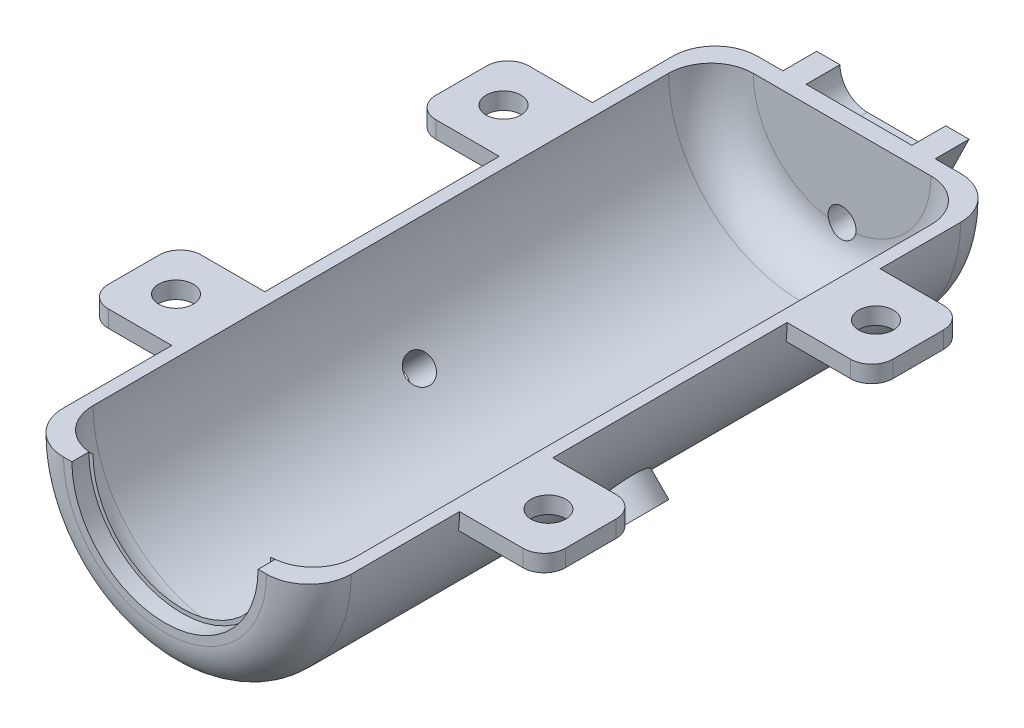
from build123d import *

# Parameters (mm, degrees)
SKETCH4_W               = 63.691174053
SKETCH4_H               = 96.012068348
CUT_EXTRUDE3_DEPTH      = 86.451740766
CUT_EXTRUDE4_DEPTH      = 86.451740766
CUT_EXTRUDE4_DEPTH_BACK = 86.451740766
SKETCH6_R               = 1.65
CUT_EXTRUDE5_DEPTH      = 90.173515588
CUT_EXTRUDE5_DEPTH_BACK = 90.173515588
SKETCH7_R               = 1.65
SKETCH9_R               = 1.65
CUT_EXTRUDE7_DEPTH      = 5
BOSS_EXTRUDE4_START     = 27
SKETCH16_R              = 3.65
SKETCH16_R_2            = 1.65
BOSS_EXTRUDE4_DEPTH     = 3.9
BOSS_EXTRUDE6_START     = -16
SKETCH17_R              = 3.65
SKETCH17_R_2            = 1.65
BOSS_EXTRUDE6_DEPTH     = 3.9
BOSS_EXTRUDE7_START     = 4
SKETCH18_R              = 1.65
BOSS_EXTRUDE7_DEPTH     = 4
CUT_EXTRUDE8_DEPTH      = 0.2
SKETCH22_R              = 2.05
BOSS_EXTRUDE8_DEPTH     = 2
MIRROR2_COPY_1_SKETCH_R = 2.05
MIRROR2_COPY_1_DEPTH    = 2


with BuildPart() as part:
    # Sketch1 → Revolve1 (revolve)
    with BuildSketch(Plane(origin=(0, 0, 0), x_dir=(0, 0, -1), z_dir=(1, 0, 0)), mode=Mode.PRIVATE) as revolve1_sk:
        with BuildLine():
            Line((0, 12), (0, 11))
            Line((0, 11), (2, 11))
            Line((2, 11), (2, 10.5))
            ThreePointArc((2, 10.5), (3.464466094, 14.035533906), (7, 15.5))
            Line((7, 15.5), (12, 15.5))
            Line((12, 15.5), (75, 15.5))
            ThreePointArc((75, 15.5), (78.535533906, 14.035533906), (80, 10.5))
            Line((80, 10.5), (80, 0))
            Line((80, 0), (82, 0))
            Line((82, 0), (82, 12))
            ThreePointArc((82, 12), (80.535533906, 15.535533906), (77, 17))
            Line((77, 17), (5, 17))
            ThreePointArc((5, 17), (1.464466094, 15.535533906), (0, 12))
        make_face()
    revolve(revolve1_sk.sketch.rotate(Axis((0, 0, 0), (0, 0, -1)), 180), axis=Axis((0, 0, 0), (0, 0, -1)))

    # Sketch4 → Cut-Extrude3 (cut, through all)
    with BuildSketch(Plane(origin=(0, 0, 0), x_dir=(1, 0, 0), z_dir=(0, 1, 0))):
        with Locations((-0.095061454, 42.091351984)):
            Rectangle(SKETCH4_W, SKETCH4_H)
    extrude(amount=CUT_EXTRUDE3_DEPTH, mode=Mode.SUBTRACT)

    # Sketch6 → Cut-Extrude4 (cut, two sides: drawn at the far end of the back side and taken through both)
    with BuildSketch(Plane(origin=(0, 0, 0), x_dir=(0.7071067811865477, 0.7071067811865475, 0), z_dir=(-0.7071067811865475, 0.7071067811865477, 0)).offset(-CUT_EXTRUDE4_DEPTH_BACK)):
        with Locations(Location((0, 41, 0), (0, 0, 180))):
            Circle(SKETCH6_R)
    extrude(amount=CUT_EXTRUDE4_DEPTH + CUT_EXTRUDE4_DEPTH_BACK, mode=Mode.SUBTRACT)

    # Sketch7 → Cut-Extrude5 (cut, two sides: drawn at the far end of the back side and taken through both)
    with BuildSketch(Plane(origin=(7.778174593, 7.778174593, 0), x_dir=(0, 0, 1), z_dir=(-0.7071067811865438, -0.7071067811865512, 0)).offset(-CUT_EXTRUDE5_DEPTH_BACK)):
        with Locations(Location((-41, 0, 0), (0, 0, 270))):
            Circle(SKETCH7_R)
    extrude(amount=CUT_EXTRUDE5_DEPTH + CUT_EXTRUDE5_DEPTH_BACK, mode=Mode.SUBTRACT)

    # Sketch9 → Cut-Extrude7 (cut)
    with BuildSketch(Plane(origin=(0, 0, -82), x_dir=(-1, 0, 0), z_dir=(0, 0, -1))):
        with Locations(Location((0, -10, 0), (0, 0, 90))):
            Circle(SKETCH9_R)
    extrude(amount=-CUT_EXTRUDE7_DEPTH, mode=Mode.SUBTRACT)

    # Sketch16 → Boss-Extrude4 (add)
    with BuildSketch(Plane(origin=(7.778174593, 7.778174593, 0), x_dir=(0, 0, 1), z_dir=(-0.7071067811865438, -0.7071067811865512, 0)).offset(BOSS_EXTRUDE4_START)):
        with Locations(Location((-41, 0, 0), (0, 0, 90))):
            Circle(SKETCH16_R)
        with Locations(Location((-41, 0, 0), (0, 0, 270))):
            Circle(SKETCH16_R_2, mode=Mode.SUBTRACT)
    extrude(amount=BOSS_EXTRUDE4_DEPTH)

    # Sketch17 → Boss-Extrude6 (add)
    with BuildSketch(Plane(origin=(0, 0, 0), x_dir=(0.7071067811865477, 0.7071067811865475, 0), z_dir=(-0.7071067811865475, 0.7071067811865477, 0)).offset(BOSS_EXTRUDE6_START)):
        with Locations(Location((0, 41, 0), (0, 0, 180))):
            Circle(SKETCH17_R)
        with Locations(Location((0, 41, 0), (0, 0, 180))):
            Circle(SKETCH17_R_2, mode=Mode.SUBTRACT)
    extrude(amount=-BOSS_EXTRUDE6_DEPTH)

    # Sketch18 → Boss-Extrude7 (add)
    with BuildSketch(Plane(origin=(0, 0, -82), x_dir=(-1, 0, 0), z_dir=(0, 0, -1)).offset(BOSS_EXTRUDE7_START)):
        with BuildLine():
            Line((-4.806077942, -8.559024607), (-9, 0))
            Line((-9, 0), (-6.25, 0))
            ThreePointArc((-6.25, 0), (-5.298097039, -2.298097039), (-3, -3.25))
            Line((-3, -3.25), (3, -3.25))
            ThreePointArc((3, -3.25), (5.298097039, -2.298097039), (6.25, 0))
            Line((6.25, 0), (9, 0))
            Line((9, 0), (4.806077942, -8.559024607))
            ThreePointArc((4.806077942, -8.559024607), (4.337052511, -9.685379412), (4.008689498, -10.860469933))
            ThreePointArc((4.008689498, -10.860469933), (0, -14.1), (-4.008689498, -10.860469933))
            ThreePointArc((-4.008689498, -10.860469933), (-4.337052511, -9.685379412), (-4.806077942, -8.559024607))
        make_face()
        with Locations(Location((0, -10, 0), (0, 0, 90))):
            Circle(SKETCH18_R, mode=Mode.SUBTRACT)
    extrude(amount=-BOSS_EXTRUDE7_DEPTH)

    # Sketch20 → Cut-Extrude8 (cut)
    with BuildSketch(Plane(origin=(0, 0, -86), x_dir=(-1, 0, 0), z_dir=(0, 0, -1))):
        Polygon((-3.746989388, -4.234271569), (-3.1811841, -4.234271569), (-1.593143234, -6.537456665), (-1.593143234, -4.234271569), (-0.964938106, -4.234271569), (-0.964938106, -7.734271569), (-1.534950125, -7.734271569), (-3.11878426, -5.438097691), (-3.11878426, -7.734271569), (-3.746989388, -7.734271569), align=None)
        Polygon((-0.157245798, -4.234271569), (0.47095933, -4.234271569), (0.47095933, -7.106066441), (1.458138817, -7.106066441), (1.458138817, -7.734271569), (-0.157245798, -7.734271569), align=None)
        Polygon((1.996600356, -4.234271569), (3.88121574, -4.234271569), (3.88121574, -4.862476697), (2.624805484, -4.862476697), (2.624805484, -5.53555362), (3.88121574, -5.53555362), (3.88121574, -6.163758749), (2.624805484, -6.163758749), (2.624805484, -7.106066441), (3.88121574, -7.106066441), (3.88121574, -7.734271569), (1.996600356, -7.734271569), align=None)
    extrude(amount=-CUT_EXTRUDE8_DEPTH, mode=Mode.SUBTRACT)

    # Sketch22 → Boss-Extrude8 (add)
    with BuildSketch(Plane(origin=(0, 0, 0), x_dir=(1, 0, 0), z_dir=(0, 1, 0))):
        with BuildLine():
            Line((-17, 56.5), (-24.5, 56.5))
            ThreePointArc((-24.5, 56.5), (-26.267766953, 57.232233047), (-27, 59))
            Line((-27, 59), (-27, 65))
            ThreePointArc((-27, 65), (-26.267766953, 66.767766953), (-24.5, 67.5))
            Line((-24.5, 67.5), (-17, 67.5))
            Line((-17, 67.5), (-16.25, 67.5))
            Line((-16.25, 67.5), (-16.25, 56.5))
            Line((-16.25, 56.5), (-17, 56.5))
        make_face()
        with Locations(Location((-22, 62, 0), (0, 0, 270))):
            Circle(SKETCH22_R, mode=Mode.SUBTRACT)
    boss_extrude8 = extrude(amount=-BOSS_EXTRUDE8_DEPTH)

    # Mirror1: Boss-Extrude8 across plane
    add(boss_extrude8.mirror(Plane(origin=(0, 0, 0), x_dir=(0, 0, 1), z_dir=(1, 0, 0))))

    # Mirror2: Boss-Extrude8 across plane
    add(boss_extrude8.mirror(Plane(origin=(0, 0, -42.65), x_dir=(1, 0, 0), z_dir=(0, 0, -1))))

    # Mirror2 copy 1 sketch → Mirror2 copy 1 (add)
    with BuildSketch(Plane(origin=(0, 0, -85.3), x_dir=(-1, 0, 0), z_dir=(0, 1, 0))):
        with BuildLine():
            Line((-17, 56.5), (-24.5, 56.5))
            ThreePointArc((-24.5, 56.5), (-26.267766953, 57.232233047), (-27, 59))
            Line((-27, 59), (-27, 65))
            ThreePointArc((-27, 65), (-26.267766953, 66.767766953), (-24.5, 67.5))
            Line((-24.5, 67.5), (-17, 67.5))
            Line((-17, 67.5), (-16.25, 67.5))
            Line((-16.25, 67.5), (-16.25, 56.5))
            Line((-16.25, 56.5), (-17, 56.5))
        make_face()
        with Locations(Location((-22, 62, 0), (0, 0, 270))):
            Circle(MIRROR2_COPY_1_SKETCH_R, mode=Mode.SUBTRACT)
    extrude(amount=-MIRROR2_COPY_1_DEPTH)


solid = part.part
